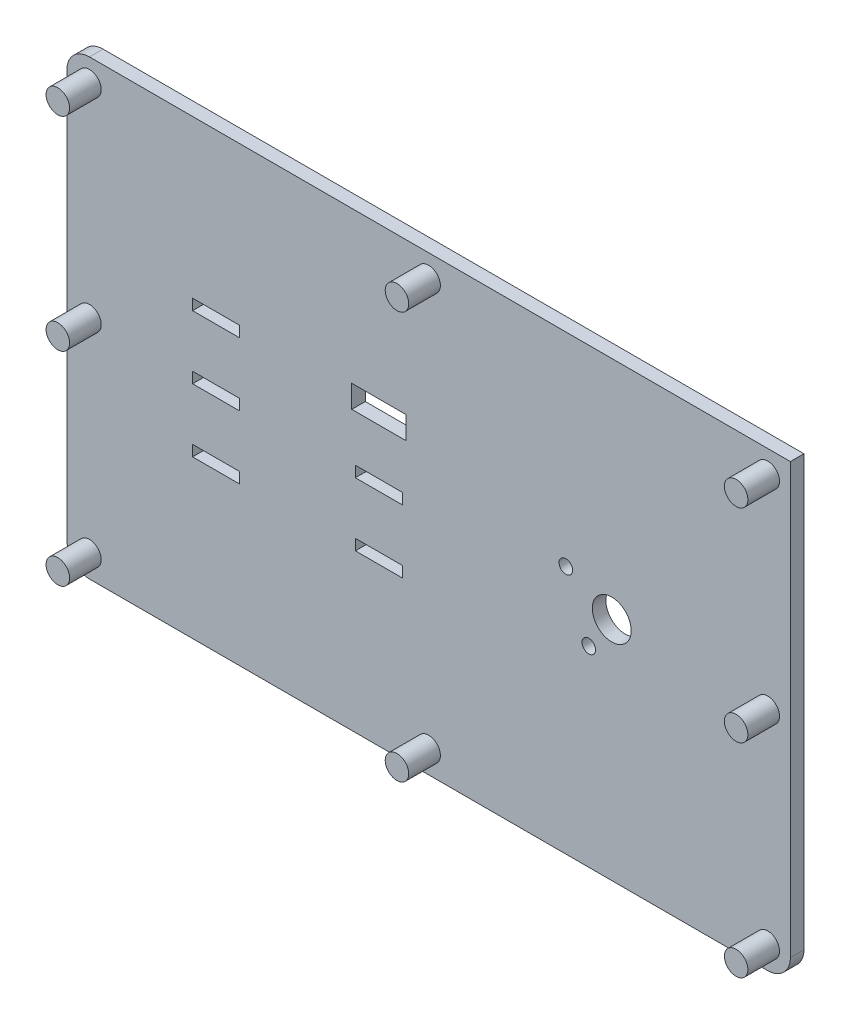
from build123d import *

# Parameters (mm, degrees)
SKETCH1_W           = 50
SKETCH1_H           = 80
BOSS_EXTRUDE5_DEPTH = 1.5
SKETCH4_R           = 1.3
BOSS_EXTRUDE6_DEPTH = 5
SKETCH6_R           = 2.15
SKETCH6_R_2         = 0.75
SKETCH6_W           = 1.2
SKETCH6_H           = 5.2
SKETCH6_W_2         = 2.5
SKETCH6_H_2         = 6
CUT_EXTRUDE1_DEPTH  = 10
FILLET1_R           = 2.5


with BuildPart() as part:
    # Sketch1 → Boss-Extrude5 (new body)
    with BuildSketch(Plane(origin=(0, 0, 0), x_dir=(0, 1, 0), z_dir=(0, 0, 1))):
        Rectangle(SKETCH1_W, SKETCH1_H)
    extrude(amount=BOSS_EXTRUDE5_DEPTH)

    # Sketch4 → Boss-Extrude6 (add)
    with BuildSketch(Plane(origin=(0, 0, 0), x_dir=(0, 1, 0), z_dir=(0, 0, 1))):
        with Locations(Location((-22.5, 37.5, 0), (0, 0, 90))):
            Circle(SKETCH4_R)
        with Locations(Location((0, 37.5, 0), (0, 0, 90))):
            Circle(SKETCH4_R)
        with Locations(Location((22.5, 37.5, 0), (0, 0, 90))):
            Circle(SKETCH4_R)
        with Locations(Location((-22.5, 0, 0), (0, 0, 90))):
            Circle(SKETCH4_R)
        with Locations(Location((22.5, 0, 0), (0, 0, 90))):
            Circle(SKETCH4_R)
        with Locations(Location((22.5, -37.5, 0), (0, 0, 90))):
            Circle(SKETCH4_R)
        with Locations(Location((0, -37.5, 0), (0, 0, 90))):
            Circle(SKETCH4_R)
        with Locations(Location((-22.5, -37.5, 0), (0, 0, 90))):
            Circle(SKETCH4_R)
    extrude(amount=BOSS_EXTRUDE6_DEPTH)

    # Sketch6 → Cut-Extrude1 (cut)
    with BuildSketch(Plane(origin=(0, 0, 0), x_dir=(0, 1, 0), z_dir=(0, 0, 1))):
        with Locations(Location((0, -20.25, 0), (0, 0, 90))):
            Circle(SKETCH6_R)
        with Locations(Location((-3.81, -17.71, 0), (0, 0, 90))):
            Circle(SKETCH6_R_2)
        with Locations(Location((2.54, -15.17, 0), (0, 0, 90))):
            Circle(SKETCH6_R_2)
        with Locations((7, 23.5)):
            Rectangle(SKETCH6_W, SKETCH6_H)
        with Locations((0, 23.5)):
            Rectangle(SKETCH6_W, SKETCH6_H)
        with Locations((-7, 23.5)):
            Rectangle(SKETCH6_W, SKETCH6_H)
        with Locations((0, 5.5)):
            Rectangle(SKETCH6_W, SKETCH6_H)
        with Locations((-7, 5.5)):
            Rectangle(SKETCH6_W, SKETCH6_H)
        with Locations((7, 5.5)):
            Rectangle(SKETCH6_W_2, SKETCH6_H_2)
    extrude(amount=CUT_EXTRUDE1_DEPTH, mode=Mode.SUBTRACT)

    # Fillet1
    fillet1_edges = [part.edges().sort_by_distance(p)[0] for p in [
        (-40, -25, 0.75),
        (-40, 25, 0.75),
        (40, -25, 0.75),
    ]]
    fillet(fillet1_edges, radius=FILLET1_R)


solid = part.part
